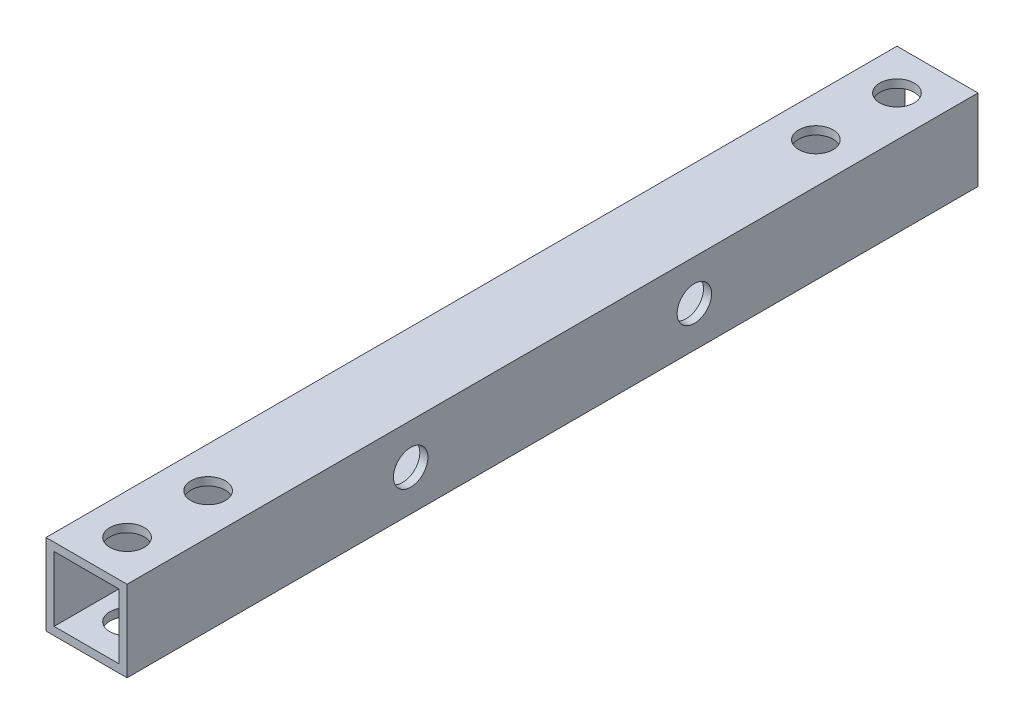
from build123d import *

# Parameters (mm, degrees)
SKETCH1_W           = 10
SKETCH1_H           = 10
SKETCH1_W_2         = 8
SKETCH1_H_2         = 8
BOSS_EXTRUDE1_DEPTH = 105
SKETCH2_R           = 2.125
CUT_EXTRUDE1_DEPTH  = 116
SKETCH4_R           = 2.125
CUT_EXTRUDE3_DEPTH  = 10


with BuildPart() as part:
    # Sketch1 → Boss-Extrude1 (new body)
    with BuildSketch(Plane.XY):
        with Locations((5, 5)):
            Rectangle(SKETCH1_W, SKETCH1_H)
        with Locations((5, 5)):
            Rectangle(SKETCH1_W_2, SKETCH1_H_2, mode=Mode.SUBTRACT)
    extrude(amount=BOSS_EXTRUDE1_DEPTH)

    # Sketch2 → Cut-Extrude1 (cut)
    with BuildSketch(Plane(origin=(0, 10, 0), x_dir=(1, 0, 0), z_dir=(0, 1, 0))):
        with Locations(Location((5, -5, 0), (0, 0, 270))):
            Circle(SKETCH2_R)
        with Locations(Location((5, -15, 0), (0, 0, 270))):
            Circle(SKETCH2_R)
        with Locations(Location((5, -100, 0), (0, 0, 270))):
            Circle(SKETCH2_R)
        with Locations(Location((5, -90, 0), (0, 0, 270))):
            Circle(SKETCH2_R)
    extrude(amount=-CUT_EXTRUDE1_DEPTH, mode=Mode.SUBTRACT)

    # Sketch4 → Cut-Extrude3 (cut)
    with BuildSketch(Plane(origin=(10, 0, 0), x_dir=(0, 0, -1), z_dir=(1, 0, 0))):
        with Locations((-70, 5)):
            Circle(SKETCH4_R)
        with Locations((-35, 5)):
            Circle(SKETCH4_R)
    extrude(amount=-CUT_EXTRUDE3_DEPTH, mode=Mode.SUBTRACT)


solid = part.part
